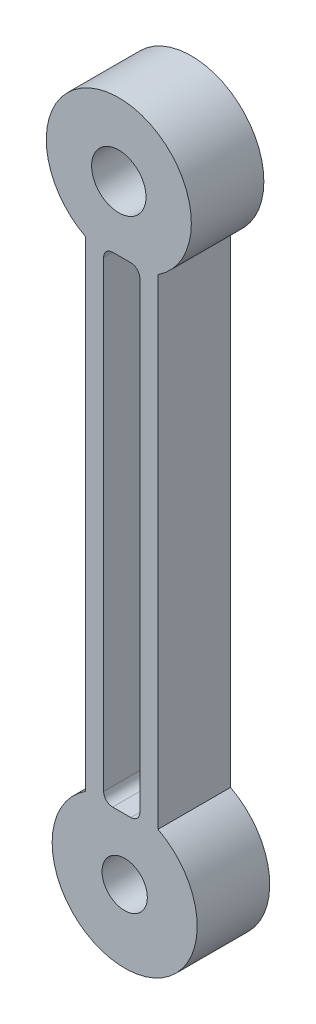
from build123d import *

# Parameters (mm, degrees)
SKETCH1_R           = 3
SKETCH1_R_2         = 2.5
BOSS_EXTRUDE1_DEPTH = 8


with BuildPart() as part:
    # Sketch1 → Boss-Extrude1 (new body)
    with BuildSketch(Plane.XY):
        with BuildLine():
            Line((4, 18), (4, 71))
            ThreePointArc((4, 71), (-0.697580374, 85.722212416), (-4, 70.625695453))
            Line((-4, 70.625695453), (-4, 17.625695453))
            ThreePointArc((-4, 17.625695453), (0.697580374, 2.903483037), (4, 18))
        make_face()
        with Locations((-0.323684855, 77.730954559)):
            Circle(SKETCH1_R, mode=Mode.SUBTRACT)
        with Locations((0.323684855, 10.894740894)):
            Circle(SKETCH1_R_2, mode=Mode.SUBTRACT)
        with BuildLine():
            Line((-2, 69.625695453), (-2, 18.625695453))
            ThreePointArc((-2, 18.625695453), (-1.707106781, 17.918588672), (-1, 17.625695453))
            Line((-1, 17.625695453), (1, 17.625695453))
            ThreePointArc((1, 17.625695453), (1.707106781, 17.918588672), (2, 18.625695453))
            Line((2, 18.625695453), (2, 69.625695453))
            ThreePointArc((2, 69.625695453), (1.707106781, 70.332802234), (1, 70.625695453))
            Line((1, 70.625695453), (-1, 70.625695453))
            ThreePointArc((-1, 70.625695453), (-1.707106781, 70.332802234), (-2, 69.625695453))
        make_face(mode=Mode.SUBTRACT)
    extrude(amount=BOSS_EXTRUDE1_DEPTH)


solid = part.part
